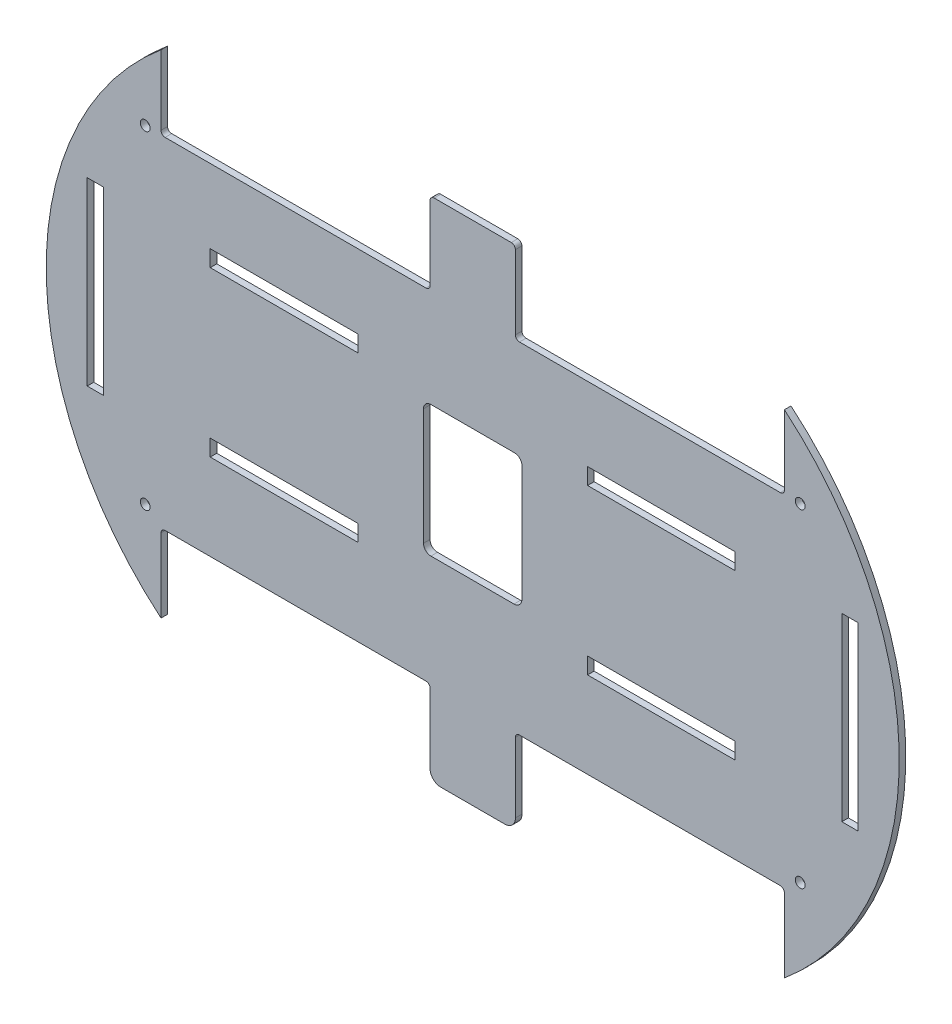
from build123d import *

# Parameters (mm, degrees)
SZKIC1_R                    = 1.5
SZKIC1_W                    = 45
SZKIC1_H                    = 5
SZKIC1_W_2                  = 5
SZKIC1_H_2                  = 55
DODANIE_WYCI_GNI_CIE3_DEPTH = 2


with BuildPart() as part:
    # Szkic1 → Dodanie-wyciągnięcie3 (new body)
    with BuildSketch(Plane.XY):
        with BuildLine():
            Line((-139.727293062, -79.5), (-120.189002398, -79.5))
            ThreePointArc((-120.189002398, -79.5), (-117.912369122, -78.544329486), (-117, -76.25))
            Line((-117, -76.25), (-117, -54.98069498))
            ThreePointArc((-117, -54.98069498), (-116.639537786, -54.110462214), (-115.76930502, -53.75))
            Line((-115.76930502, -53.75), (-102.427025017, -53.75))
            Line((-102.427025017, -53.75), (-87.218924948, -53.75))
            Line((-87.218924948, -53.75), (-36.25, -53.75))
            ThreePointArc((-36.25, -53.75), (-35.366116524, -54.116116524), (-35, -55))
            Line((-35, -55), (-35, -77.5))
            ThreePointArc((-35, -77.5), (0, -2.5), (-35, 72.5))
            Line((-35, 72.5), (-35, 51.25))
            ThreePointArc((-35, 51.25), (-35.366116524, 50.366116524), (-36.25, 50))
            Line((-36.25, 50), (-90.072974983, 50))
            Line((-90.072974983, 50), (-102.072974983, 50))
            Line((-102.072974983, 50), (-115.75, 50))
            ThreePointArc((-115.75, 50), (-116.633883476, 50.366116524), (-117, 51.25))
            Line((-117, 51.25), (-117, 73.75))
            ThreePointArc((-117, 73.75), (-117.366116524, 74.633883476), (-118.25, 75))
            Line((-118.25, 75), (-141.75, 75))
            ThreePointArc((-141.75, 75), (-142.633883476, 74.633883476), (-143, 73.75))
            Line((-143, 73.75), (-143, 51.25))
            ThreePointArc((-143, 51.25), (-143.366116524, 50.366116524), (-144.25, 50))
            Line((-144.25, 50), (-157.927025017, 50))
            Line((-157.927025017, 50), (-169.927025017, 50))
            Line((-169.927025017, 50), (-223.75, 50))
            ThreePointArc((-223.75, 50), (-224.633883476, 50.366116524), (-225, 51.25))
            Line((-225, 51.25), (-225, 72.5))
            ThreePointArc((-225, 72.5), (-260, -2.5), (-225, -77.5))
            Line((-225, -77.5), (-225, -55))
            ThreePointArc((-225, -55), (-224.633883476, -54.116116524), (-223.75, -53.75))
            Line((-223.75, -53.75), (-172.781075052, -53.75))
            Line((-172.781075052, -53.75), (-157.572974983, -53.75))
            Line((-157.572974983, -53.75), (-144.25, -53.75))
            ThreePointArc((-144.25, -53.75), (-143.366116524, -54.116116524), (-143, -55))
            Line((-143, -55), (-143, -76.237644119))
            ThreePointArc((-143, -76.237644119), (-142.040816528, -78.548140635), (-139.727293062, -79.5))
        make_face()
        with Locations((-229.818345238, 50.110219647)):
            Circle(SZKIC1_R, mode=Mode.SUBTRACT)
        with Locations((-229.818345238, -49.889780353)):
            Circle(SZKIC1_R, mode=Mode.SUBTRACT)
        with Locations(Location((-30.181654762, -49.889780353, 0), (0, 0, 180))):
            Circle(SZKIC1_R, mode=Mode.SUBTRACT)
        with Locations(Location((-30.181654762, 50.110219647, 0), (0, 0, 180))):
            Circle(SZKIC1_R, mode=Mode.SUBTRACT)
        with Locations((-187.5, 25)):
            Rectangle(SZKIC1_W, SZKIC1_H, mode=Mode.SUBTRACT)
        with Locations((-187.5, -25)):
            Rectangle(SZKIC1_W, SZKIC1_H, mode=Mode.SUBTRACT)
        with Locations((-72.5, -25)):
            Rectangle(SZKIC1_W, SZKIC1_H, mode=Mode.SUBTRACT)
        with Locations((-72.5, 25)):
            Rectangle(SZKIC1_W, SZKIC1_H, mode=Mode.SUBTRACT)
        with Locations((-15, 0)):
            Rectangle(SZKIC1_W_2, SZKIC1_H_2, mode=Mode.SUBTRACT)
        with Locations((-245, 0)):
            Rectangle(SZKIC1_W_2, SZKIC1_H_2, mode=Mode.SUBTRACT)
        with BuildLine():
            Line((-142.75, 20), (-117.25, 20))
            ThreePointArc((-117.25, 20), (-115.659009742, 19.340990258), (-115, 17.75))
            Line((-115, 17.75), (-115, -17.572974983))
            ThreePointArc((-115, -17.572974983), (-115.71085917, -19.28914083), (-117.427025017, -20))
            Line((-117.427025017, -20), (-142.75, -20))
            ThreePointArc((-142.75, -20), (-144.340990258, -19.340990258), (-145, -17.75))
            Line((-145, -17.75), (-145, 17.75))
            ThreePointArc((-145, 17.75), (-144.340990258, 19.340990258), (-142.75, 20))
        make_face(mode=Mode.SUBTRACT)
    extrude(amount=DODANIE_WYCI_GNI_CIE3_DEPTH)


solid = part.part
